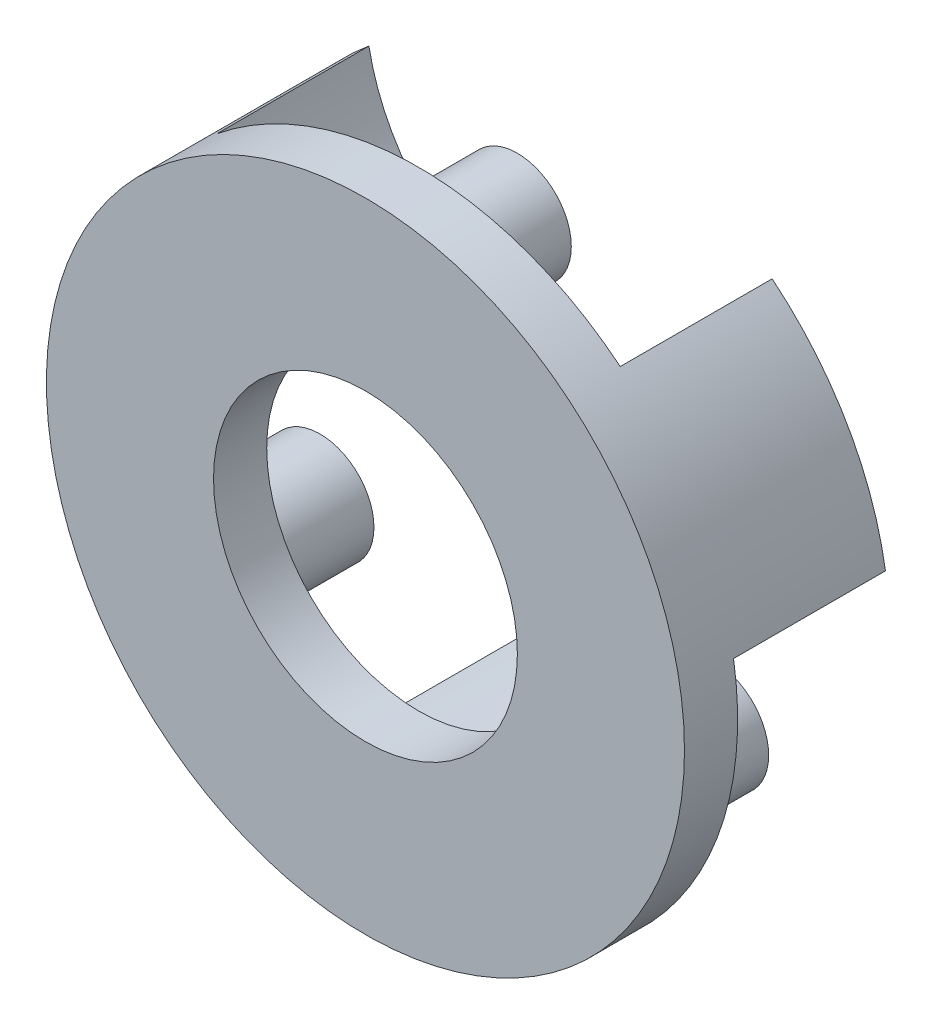
from build123d import *
from build123d.topology import SkipClean

# Parameters (mm, degrees)
SKETCH1_R           = 21
BOSS_EXTRUDE1_DEPTH = 3.5
SKETCH4_R           = 10
CUT_EXTRUDE1_DEPTH  = 8.2
SKETCH11_R          = 1.5
CUT_EXTRUDE2_DEPTH  = 10
BOSS_EXTRUDE2_START = 10
BOSS_EXTRUDE2_DEPTH = 10
SKETCH14_R          = 1.5
CUT_EXTRUDE3_DEPTH  = 5
SKETCH16_R          = 3.55
BOSS_EXTRUDE3_DEPTH = 10


with BuildPart() as part:
    # Sketch1 → Boss-Extrude1 (new body)
    with BuildSketch(Plane.XY):
        Circle(SKETCH1_R)
    extrude(amount=BOSS_EXTRUDE1_DEPTH)

    # Sketch4 → Cut-Extrude1 (cut)
    with BuildSketch(Plane(origin=(0, 0, 0), x_dir=(-1, 0, 0), z_dir=(0, 0, -1))):
        Circle(SKETCH4_R)
    extrude(amount=-CUT_EXTRUDE1_DEPTH, mode=Mode.SUBTRACT)

    # Sketch11 → Cut-Extrude2 (cut)
    with BuildSketch(Plane(origin=(0, 0, 0), x_dir=(-1, 0, 0), z_dir=(0, 0, -1))):
        with Locations((0, 15)):
            Circle(SKETCH11_R)
        with Locations((12.990381057, -7.5)):
            Circle(SKETCH11_R)
        with Locations((-12.990381057, -7.5)):
            Circle(SKETCH11_R)
    extrude(amount=-CUT_EXTRUDE2_DEPTH, mode=Mode.SUBTRACT)

    # Sketch3 → Boss-Extrude2 (add)
    with SkipClean():  # the faces are left unmerged after this step: merging them gives an invalid solid
        with BuildSketch(Plane(origin=(0, 0, 0), x_dir=(-1, 0, 0), z_dir=(0, 0, -1)).offset(BOSS_EXTRUDE2_START)):
            with BuildLine():
                ThreePointArc((-3.021915591, -12.129221993), (-4.618435811, -16.247865366), (-7.4589705, -19.630684121))
                ThreePointArc((-7.4589705, -19.630684121), (0, -21), (7.4589705, -19.630684121))
                ThreePointArc((7.4589705, -19.630684121), (4.618435811, -16.247865366), (3.021915591, -12.129221993))
                ThreePointArc((3.021915591, -12.129221993), (0, -12.5), (-3.021915591, -12.129221993))
            make_face()
            with BuildLine():
                ThreePointArc((-20.730156393, 3.355684121), (-16.38028207, 4.124249945), (-12.01517217, 3.447555327))
                ThreePointArc((-12.01517217, 3.447555327), (-10.825317547, 6.25), (-8.993256579, 8.681666667))
                ThreePointArc((-8.993256579, 8.681666667), (-11.761846259, 12.123615422), (-13.271185893, 16.275))
                ThreePointArc((-13.271185893, 16.275), (-18.186533479, 10.5), (-20.730156393, 3.355684121))
            make_face()
            with BuildLine():
                ThreePointArc((8.993256579, 8.681666667), (10.825317547, 6.25), (12.01517217, 3.447555327))
                ThreePointArc((12.01517217, 3.447555327), (16.38028207, 4.124249945), (20.730156393, 3.355684121))
                ThreePointArc((20.730156393, 3.355684121), (18.186533479, 10.5), (13.271185893, 16.275))
                ThreePointArc((13.271185893, 16.275), (11.761846259, 12.123615422), (8.993256579, 8.681666667))
            make_face()
        extrude(amount=-BOSS_EXTRUDE2_DEPTH)

    # Sketch14 → Cut-Extrude3 (cut)
    with SkipClean():  # the faces are left unmerged after this step: merging them gives an invalid solid
        with BuildSketch(Plane(origin=(0, 0, -10), x_dir=(-1, 0, 0), z_dir=(0, 0, -1))):
            with Locations((13.856406461, 8)):
                Circle(SKETCH14_R)
            with Locations((0, -16)):
                Circle(SKETCH14_R)
            with Locations((-13.856406461, 8)):
                Circle(SKETCH14_R)
        extrude(amount=-CUT_EXTRUDE3_DEPTH, mode=Mode.SUBTRACT)

    # Sketch16 → Boss-Extrude3 (add)
    with SkipClean():  # the faces are left unmerged after this step: merging them gives an invalid solid
        with BuildSketch(Plane.XY.offset(3.5)):
            with Locations((0, 15)):
                Circle(SKETCH16_R)
            with Locations((12.990381057, -7.5)):
                Circle(SKETCH16_R)
            with Locations((-12.990381057, -7.5)):
                Circle(SKETCH16_R)
        extrude(amount=-BOSS_EXTRUDE3_DEPTH)


solid = part.part
